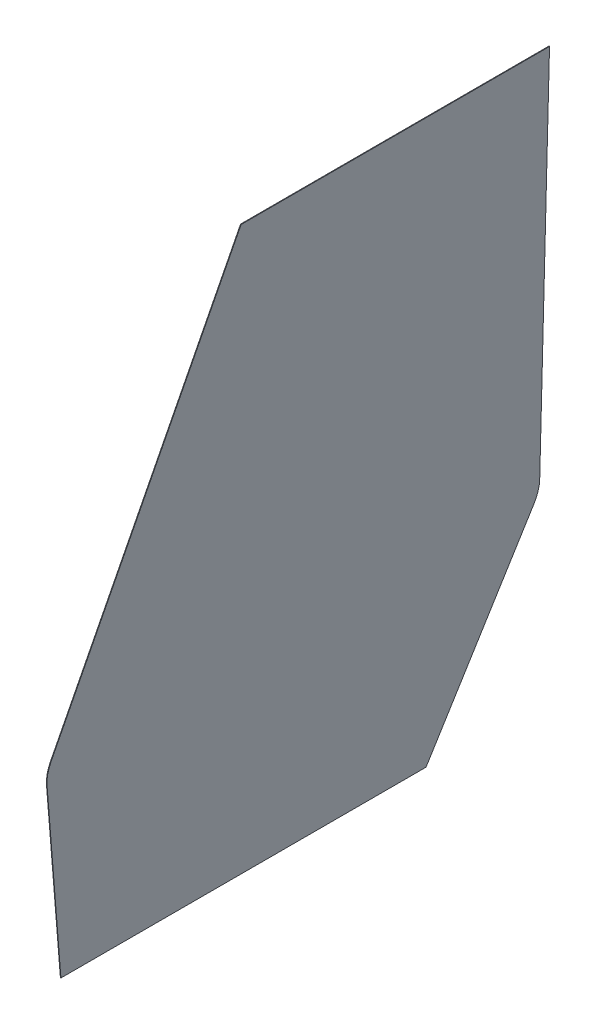
from build123d import *

# Parameters (mm, degrees)
BOSS_EXTRUDE1_DEPTH = 1


with BuildPart() as part:
    # Sketch2 → Boss-Extrude1 (new body)
    with BuildSketch(Plane(origin=(251.023475103, -53.356686766, 0), x_dir=(0, 0, -1), z_dir=(0.9781476007338064, -0.20791169081775637, 0))):
        with BuildLine():
            Line((-448.287218693, -68.060453412), (-282.992628726, 813.510693083))
            Line((-282.992628726, 813.510693083), (282.992628726, 813.510693083))
            Line((282.992628726, 813.510693083), (448.287218693, -68.060453412))
            ThreePointArc((448.287218693, -68.060453412), (449.924211951, -90.381846712), (446.555758158, -112.508253217))
            Line((446.555758158, -112.508253217), (335, -526.489306917))
            Line((335, -526.489306917), (-335, -526.489306917))
            Line((-335, -526.489306917), (-446.555758158, -112.508253217))
            ThreePointArc((-446.555758158, -112.508253217), (-449.924211951, -90.381846712), (-448.287218693, -68.060453412))
        make_face()
    extrude(amount=BOSS_EXTRUDE1_DEPTH)


solid = part.part
